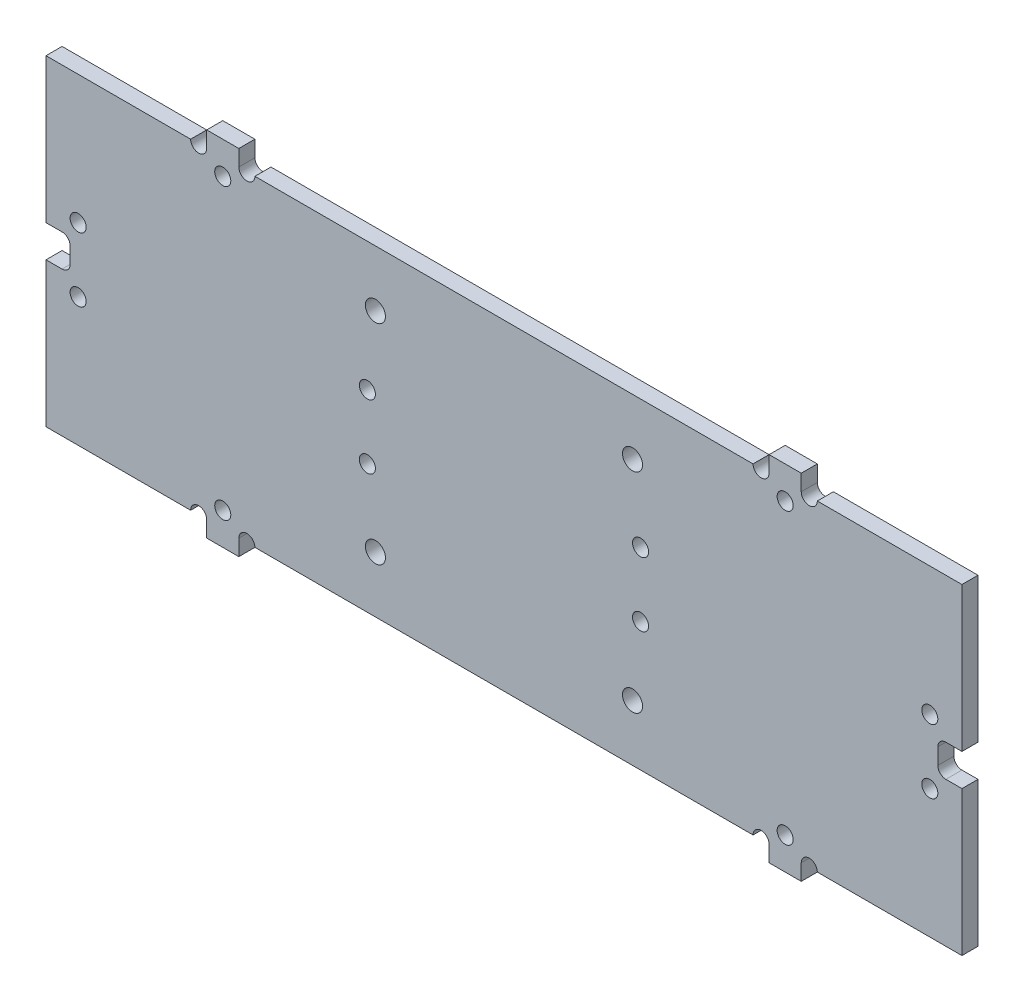
from build123d import *

# Parameters (mm, degrees)
SKETCH_3_R          = 1
EXTRUDE_3_DEPTH     = 2
SKETCH_4_R          = 1
CUT_EXTRUDE_2_DEPTH = 2
SKETCH_6_R          = 1.25
CUT_EXTRUDE_6_DEPTH = 2
SKETCH_7_R          = 1
CUT_EXTRUDE_7_DEPTH = 10
SKETCH_8_W          = 4
SKETCH_8_H          = 2
EXTRUDE_6_DEPTH     = 2
CUT_EXTRUDE_8_DEPTH = 2


with BuildPart() as part:
    # 草圖3 → 填料-伸長3 (new body)
    with BuildSketch(Plane.XY):
        Polygon((1, 40), (0, 40), (0, 39), (0, 1), (0, 0), (1, 0), (113, 0), (114, 0), (114, 1), (114, 39), (114, 40), (113, 40), align=None)
        with Locations((4, 24)):
            Circle(SKETCH_3_R, mode=Mode.SUBTRACT)
        with Locations((4, 16)):
            Circle(SKETCH_3_R, mode=Mode.SUBTRACT)
        with Locations(Location((110, 16, 0), (0, 0, 180))):
            Circle(SKETCH_3_R, mode=Mode.SUBTRACT)
        with Locations(Location((110, 24, 0), (0, 0, 180))):
            Circle(SKETCH_3_R, mode=Mode.SUBTRACT)
    extrude(amount=EXTRUDE_3_DEPTH)

    # 草圖4 → 除料-伸長2 (cut)
    with BuildSketch(Plane.XY.offset(2)):
        with Locations((40, 24)):
            Circle(SKETCH_4_R)
        with Locations((40, 16)):
            Circle(SKETCH_4_R)
        with Locations(Location((74, 16, 0), (0, 0, 180))):
            Circle(SKETCH_4_R)
        with Locations(Location((74, 24, 0), (0, 0, 180))):
            Circle(SKETCH_4_R)
    extrude(amount=-CUT_EXTRUDE_2_DEPTH, mode=Mode.SUBTRACT)

    # 草圖6 → 除料-伸長6 (cut)
    with BuildSketch(Plane.XY.offset(2)):
        with Locations((41, 33)):
            Circle(SKETCH_6_R)
        with Locations((73, 33)):
            Circle(SKETCH_6_R)
        with Locations((73, 7)):
            Circle(SKETCH_6_R)
        with Locations((41, 7)):
            Circle(SKETCH_6_R)
    extrude(amount=-CUT_EXTRUDE_6_DEPTH, mode=Mode.SUBTRACT)

    # 草圖7 → 除料-伸長7 (cut)
    with BuildSketch(Plane.XY.offset(2)):
        with Locations((22, 38)):
            Circle(SKETCH_7_R)
        with Locations((92, 38)):
            Circle(SKETCH_7_R)
        with Locations((92, 2)):
            Circle(SKETCH_7_R)
        with Locations((22, 2)):
            Circle(SKETCH_7_R)
    extrude(amount=-CUT_EXTRUDE_7_DEPTH, mode=Mode.SUBTRACT)

    # 草圖8 → 填料-伸長6 (add)
    with BuildSketch(Plane.XY.offset(2)):
        with Locations((22, 41)):
            Rectangle(SKETCH_8_W, SKETCH_8_H)
        with Locations((22, -1)):
            Rectangle(SKETCH_8_W, SKETCH_8_H)
        with Locations((92, -1)):
            Rectangle(SKETCH_8_W, SKETCH_8_H)
        with Locations((92, 41)):
            Rectangle(SKETCH_8_W, SKETCH_8_H)
    extrude(amount=-EXTRUDE_6_DEPTH)

    # 草圖9 → 除料-伸長8 (cut)
    with BuildSketch(Plane.XY.offset(2)):
        with BuildLine():
            Line((0, 22), (2, 22))
            ThreePointArc((2, 22), (2.707106781, 21.707106781), (3, 21))
            Line((3, 21), (3, 19))
            ThreePointArc((3, 19), (2.707106781, 18.292893219), (2, 18))
            Line((2, 18), (0, 18))
            Line((0, 18), (0, 22))
        make_face()
        with BuildLine():
            Line((18, 40), (20, 40))
            ThreePointArc((20, 40), (19, 39), (18, 40))
        make_face()
        with BuildLine():
            Line((24, 40), (26, 40))
            ThreePointArc((26, 40), (25, 39), (24, 40))
        make_face()
        with BuildLine():
            Line((18, 0), (20, 0))
            ThreePointArc((20, 0), (19, 1), (18, 0))
        make_face()
        with BuildLine():
            Line((24, 0), (26, 0))
            ThreePointArc((26, 0), (25, 1), (24, 0))
        make_face()
        with BuildLine():
            Line((90, 0), (88, 0))
            ThreePointArc((88, 0), (89, 1), (90, 0))
        make_face()
        with BuildLine():
            Line((96, 0), (94, 0))
            ThreePointArc((94, 0), (95, 1), (96, 0))
        make_face()
        with BuildLine():
            Line((90, 40), (88, 40))
            ThreePointArc((88, 40), (89, 39), (90, 40))
        make_face()
        with BuildLine():
            Line((111, 21), (111, 19))
            ThreePointArc((111, 19), (111.292893219, 18.292893219), (112, 18))
            Line((112, 18), (114, 18))
            Line((114, 18), (114, 22))
            Line((114, 22), (112, 22))
            ThreePointArc((112, 22), (111.292893219, 21.707106781), (111, 21))
        make_face()
        with BuildLine():
            Line((96, 40), (94, 40))
            ThreePointArc((94, 40), (95, 39), (96, 40))
        make_face()
    extrude(amount=-CUT_EXTRUDE_8_DEPTH, mode=Mode.SUBTRACT)


solid = part.part
